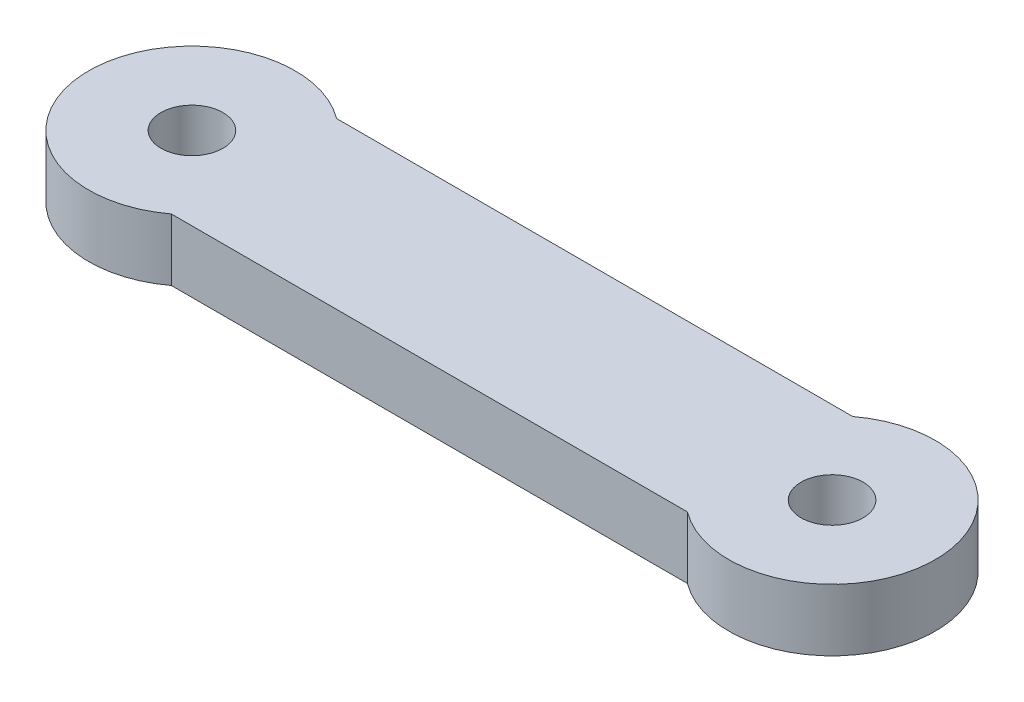
from build123d import *

# Parameters (mm, degrees)
CROQUIS1_R              = 1.5
SALIENTE_EXTRUIR1_DEPTH = 3


with BuildPart() as part:
    # Croquis1 → Saliente-Extruir1 (new body)
    with BuildSketch(Plane(origin=(0, 0, 0), x_dir=(1, 0, 0), z_dir=(0, 1, 0))):
        with BuildLine():
            Line((-12.4902, 4), (12.4902, 4))
            ThreePointArc((12.4902, 4), (20.4902, 0), (12.4902, -4))
            Line((12.4902, -4), (-12.4902, -4))
            ThreePointArc((-12.4902, -4), (-20.4902, 0), (-12.4902, 4))
        make_face()
        with Locations(Location((-15.4902, 0, 0), (0, 0, 270))):
            Circle(CROQUIS1_R, mode=Mode.SUBTRACT)
        with Locations(Location((15.4902, 0, 0), (0, 0, 90))):
            Circle(CROQUIS1_R, mode=Mode.SUBTRACT)
    extrude(amount=SALIENTE_EXTRUIR1_DEPTH)


solid = part.part
